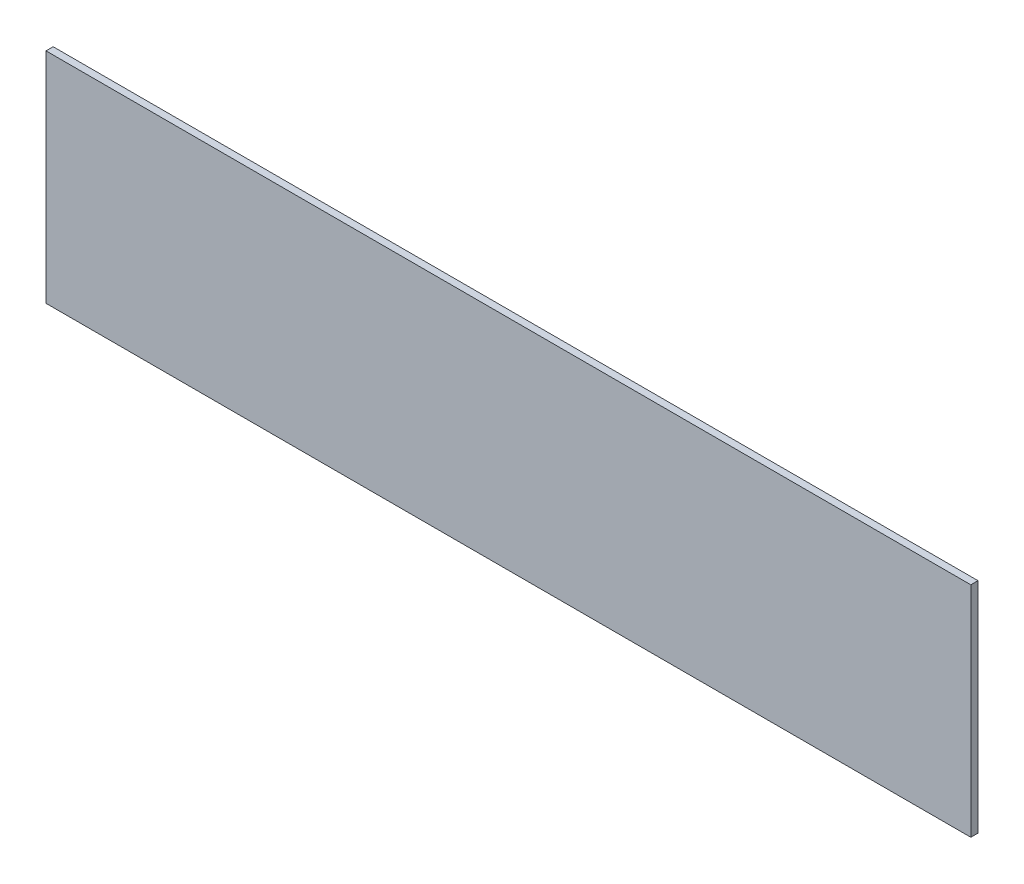
from build123d import *

# Parameters (mm, degrees)
BOSS_EXTRUDE1_DEPTH = 4


with BuildPart() as part:
    # Sketch1 → Boss-Extrude1 (new body)
    with BuildSketch(Plane.XY):
        Polygon((-258, -61), (185.485837704, -61), (258, -61), (258, 61), (-258, 61), align=None)
    extrude(amount=BOSS_EXTRUDE1_DEPTH)


solid = part.part
